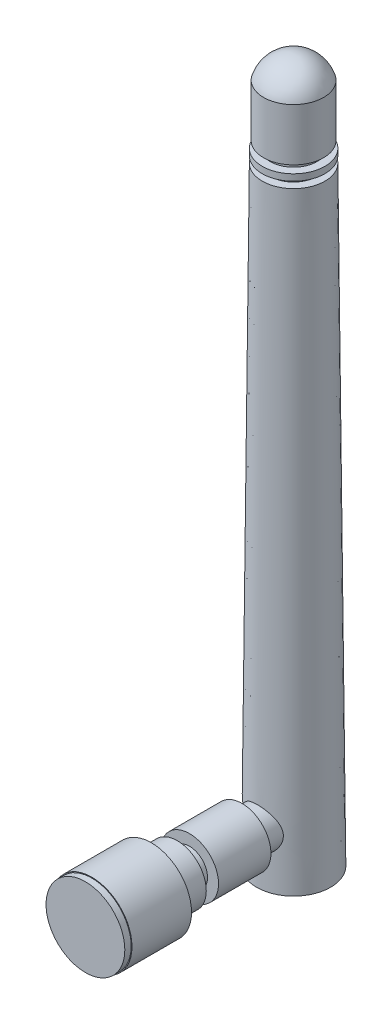
from build123d import *


with BuildPart() as part:
    # 草图1 → 旋转1 (revolve)
    with BuildSketch(Plane.XY, mode=Mode.PRIVATE) as revolve_1_sk:
        with BuildLine():
            Line((0, -8.871116041), (-4.6, -8.871116041))
            Line((-4.6, -8.871116041), (-3.9, 66.878718358))
            Line((-3.9, 66.878718358), (-2.9, 66.878718358))
            Line((-2.9, 66.878718358), (-2.9, 67.678718358))
            Line((-2.9, 67.678718358), (-3.9, 67.678718358))
            Line((-3.9, 67.678718358), (-3.9, 68.478718358))
            Line((-3.9, 68.478718358), (-2.9, 68.478718358))
            Line((-2.9, 68.478718358), (-2.9, 69.316506289))
            Line((-2.9, 69.316506289), (-3.735091076, 69.316506289))
            Line((-3.735091076, 69.316506289), (-3.735091076, 75.816506289))
            ThreePointArc((-3.735091076, 75.816506289), (-2.337753917, 77.847174239), (0, 78.628883959))
            Line((0, 78.628883959), (0, -8.871116041))
        make_face()
    revolve(revolve_1_sk.sketch.rotate(Axis((0, 100.774977187, 0), (0, -1, 0)), 270), axis=Axis((0, 100.774977187, 0), (0, -1, 0)))

    # 草图2 → Revolve 883 (revolve)
    with BuildSketch(Plane(origin=(0, 0, 0), x_dir=(0, 0, -1), z_dir=(1, 0, 0)), mode=Mode.PRIVATE) as revolve_883_sk:
        Polygon((0, 0), (-6.429276603, 0), (-6.429276603, 1.099364131), (-12.95, 1.099364131), (-12.95, -0.266872358), (-14.47347065, -0.266872358), (-14.47347065, 1.099364131), (-17.7, 1.099364131), (-17.7, 2.489950524), (-25.109397803, 2.489950524), (-25.109397803, 2.389950524), (-25.9, 2.389950524), (-25.9, -2.510049476), (0, -2.510049476), align=None)
    revolve(revolve_883_sk.sketch.rotate(Axis((0, -2.510049476, 44.503458482), (0, 0, -1)), 90), axis=Axis((0, -2.510049476, 44.503458482), (0, 0, -1)))


solid = part.part
